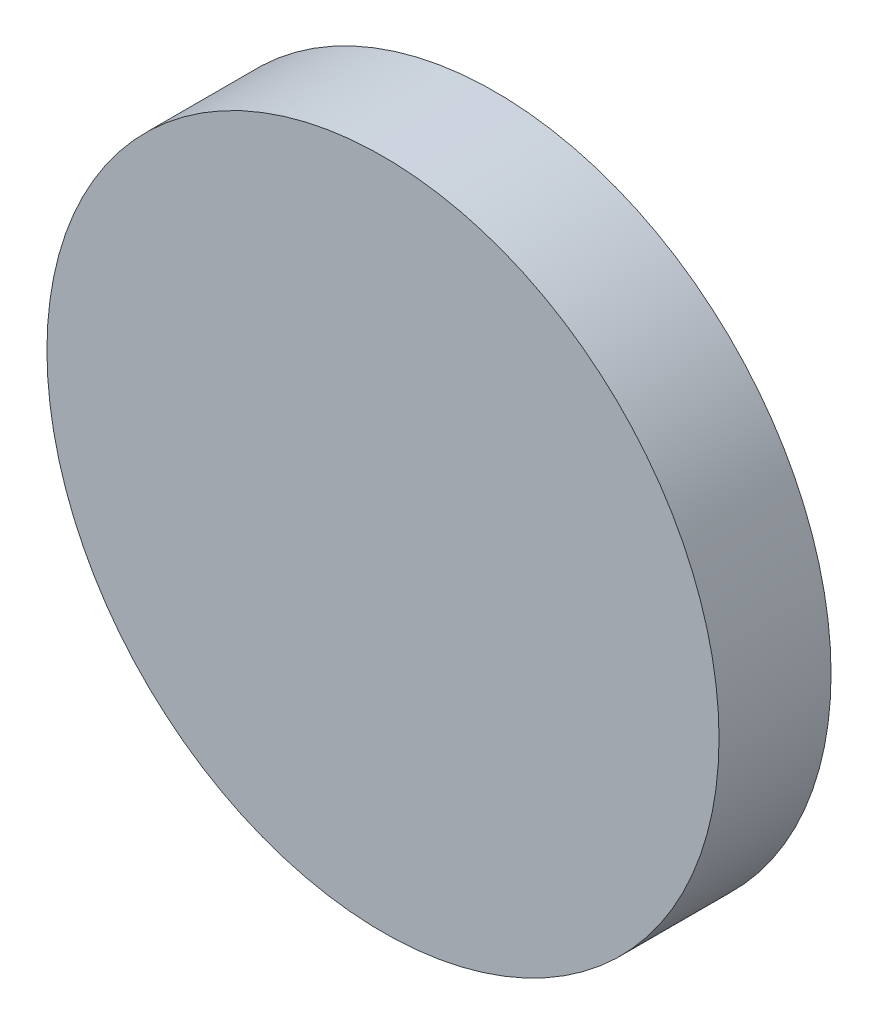
from build123d import *

# Parameters (mm, degrees)
SKETCH1_R           = 10
BOSS_EXTRUDE1_DEPTH = 12


with BuildPart() as part:
    # Sketch1 → Boss-Extrude1 (new body)
    with BuildSketch(Plane.XY):
        Circle(SKETCH1_R)
    extrude(amount=BOSS_EXTRUDE1_DEPTH)

    # Sketch3 → Cut-Revolve1 (revolve, cut)
    with BuildSketch(Plane(origin=(0, 0, 0), x_dir=(1, 0, 0), z_dir=(0, 1, 0))):
        with BuildLine():
            Line((0, -9), (0, 291))
            ThreePointArc((0, 291), (-150, 141), (0, -9))
        make_face()
    revolve(axis=Axis((0, 0, 9), (0, 0, -1)), mode=Mode.SUBTRACT)


solid = part.part
